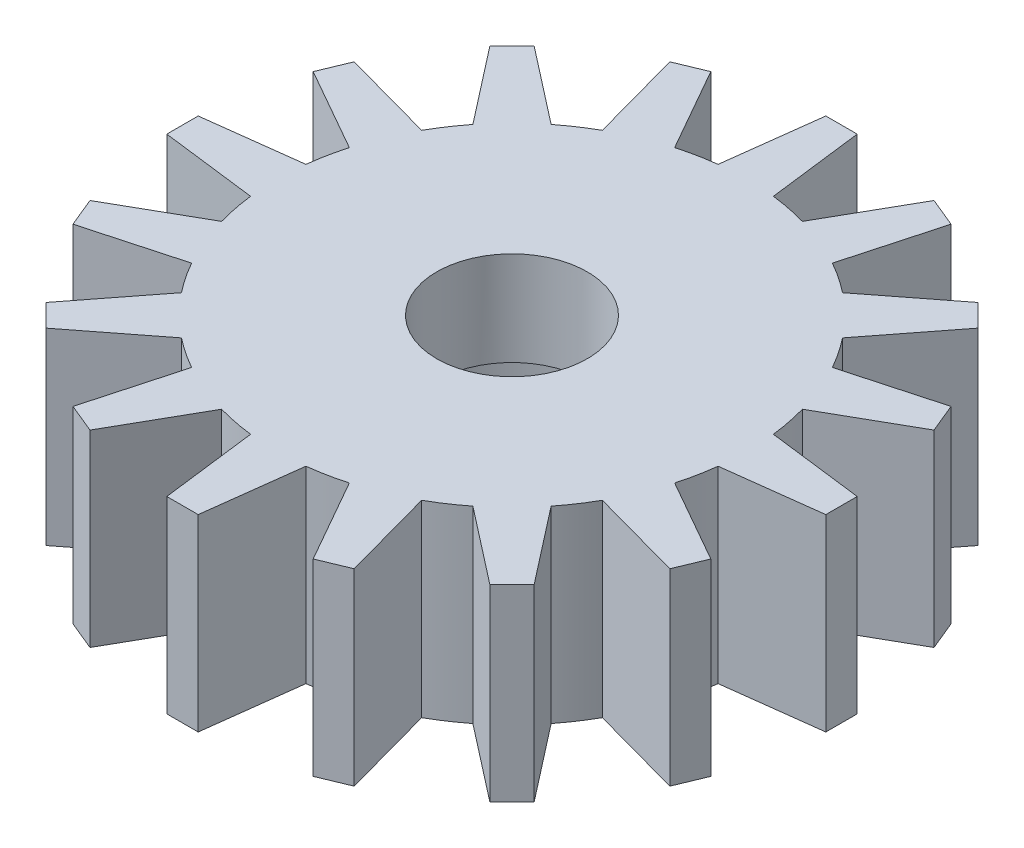
from build123d import *

# Parameters (mm, degrees)
SKETCH1_R           = 18.75
BOSS_EXTRUDE1_DEPTH = 15
BOSS_EXTRUDE2_START = -15
BOSS_EXTRUDE2_DEPTH = 15
CIRPATTERN1_COUNT   = 16
SKETCH3_R           = 6
CUT_EXTRUDE1_DEPTH  = 41.039043445
SKETCH4_R           = 12.5
CUT_EXTRUDE2_DEPTH  = 7.5


with BuildPart() as part:
    # Sketch1 → Boss-Extrude1 (new body)
    with BuildSketch(Plane(origin=(0, 0, 0), x_dir=(1, 0, 0), z_dir=(0, 1, 0))):
        with Locations(Location((0, 0, 0), (0, 0, 270))):
            Circle(SKETCH1_R)
    extrude(amount=BOSS_EXTRUDE1_DEPTH)

    # Sketch2 → Boss-Extrude2 (add)
    with BuildSketch(Plane(origin=(0, 15, 0), x_dir=(1, 0, 0), z_dir=(0, 1, 0)).offset(BOSS_EXTRUDE2_START)):
        with BuildLine():
            Line((-1.25, 26.25), (1.25, 26.25))
            Line((1.25, 26.25), (2.203742352, 18.620043492))
            ThreePointArc((2.203742352, 18.620043492), (0, 18.75), (-2.203742352, 18.620043492))
            Line((-2.203742352, 18.620043492), (-1.25, 26.25))
        make_face()
    boss_extrude2 = extrude(amount=BOSS_EXTRUDE2_DEPTH)

    # CirPattern1: Boss-Extrude2 ×16 about axis
    cirpattern1_axis = Axis((0, 0, 0), (0, 1, 0))
    for i in range(1, CIRPATTERN1_COUNT):
        add(boss_extrude2.rotate(cirpattern1_axis, i * 360 / CIRPATTERN1_COUNT))

    # Sketch3 → Cut-Extrude1 (cut, through all)
    with BuildSketch(Plane(origin=(0, 15, 0), x_dir=(1, 0, 0), z_dir=(0, 1, 0))):
        with Locations(Location((0, 0, 0), (0, 0, 270))):
            Circle(SKETCH3_R)
    extrude(amount=-CUT_EXTRUDE1_DEPTH, mode=Mode.SUBTRACT)

    # Sketch4 → Cut-Extrude2 (cut)
    with BuildSketch(Plane(origin=(0, 0, 0), x_dir=(-1, 0, 0), z_dir=(0, -1, 0))):
        with Locations(Location((0, 0, 0), (0, 0, 90))):
            Circle(SKETCH4_R)
    extrude(amount=-CUT_EXTRUDE2_DEPTH, mode=Mode.SUBTRACT)


solid = part.part
